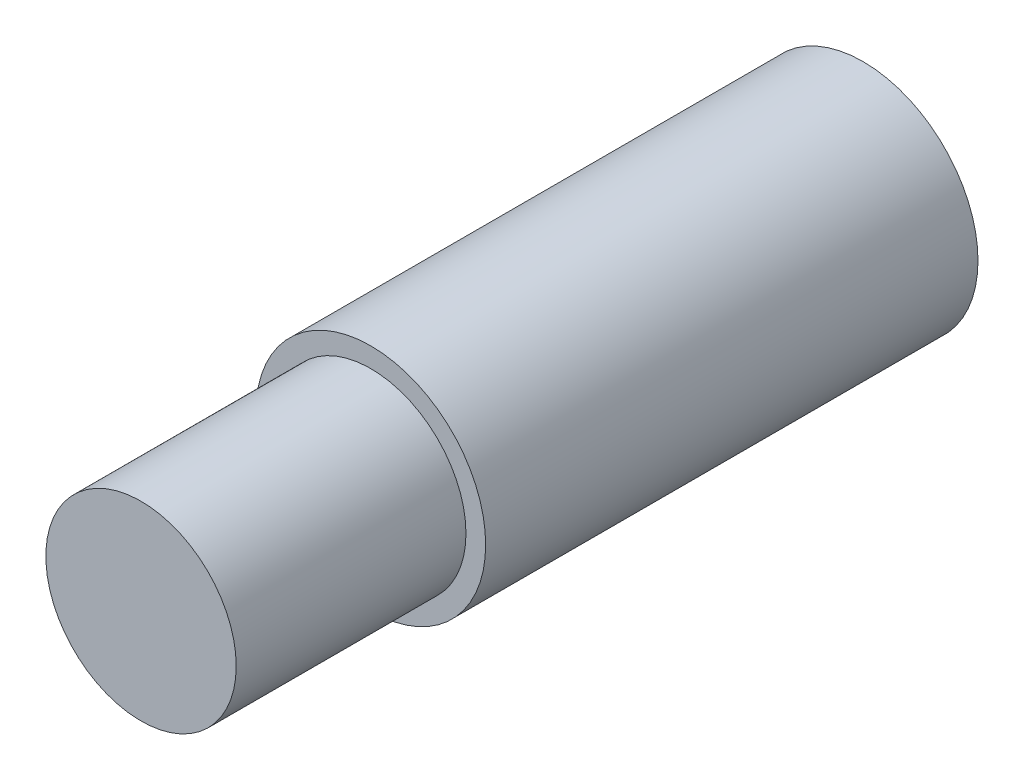
from build123d import *

# Parameters (mm, degrees)
SKETCH1_R           = 3.5
BOSS_EXTRUDE1_DEPTH = 15
SKETCH2_R           = 2.9
BOSS_EXTRUDE2_DEPTH = 7


with BuildPart() as part:
    # Sketch1 → Boss-Extrude1 (new body)
    with BuildSketch(Plane.XY):
        Circle(SKETCH1_R)
    extrude(amount=BOSS_EXTRUDE1_DEPTH)

    # Sketch2 → Boss-Extrude2 (add)
    with BuildSketch(Plane.XY.offset(15)):
        Circle(SKETCH2_R)
    extrude(amount=BOSS_EXTRUDE2_DEPTH)


solid = part.part
